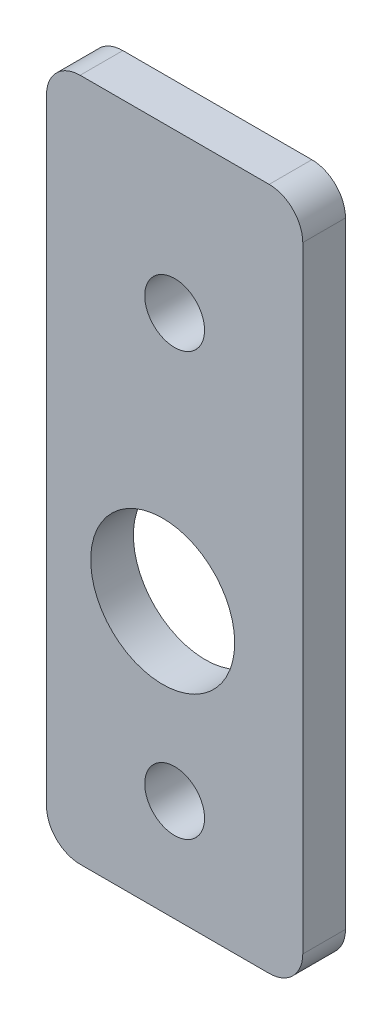
from build123d import *

# Parameters (mm, degrees)
SKETCH1_W           = 38.1
SKETCH1_H           = 101.6
SKETCH1_R           = 10.7061
BOSS_EXTRUDE1_DEPTH = 6.35
CUT_EXTRUDE1_REACH  = 110.694
SKETCH2_R           = 4.445
FILLET1_R           = 5


with BuildPart() as part:
    # Sketch1 → Boss-Extrude1 (new body)
    with BuildSketch(Plane.XY):
        with Locations((19.05, -50.8)):
            Rectangle(SKETCH1_W, SKETCH1_H)
        with Locations((17.272, -61.6)):
            Circle(SKETCH1_R, mode=Mode.SUBTRACT)
    extrude(amount=BOSS_EXTRUDE1_DEPTH)

    # Sketch2 → Cut-Extrude1 (cut, up to next)
    with BuildSketch(Plane.XY.offset(6.35), mode=Mode.PRIVATE) as cut_extrude1_sk1:
        with Locations((19.05, -23.588381621)):
            Circle(SKETCH2_R)
    cut_extrude1_tool1 = extrude(cut_extrude1_sk1.sketch, amount=-CUT_EXTRUDE1_REACH, mode=Mode.PRIVATE) & part.part
    # Sketch2 → Cut-Extrude1 (cut, up to next)
    with BuildSketch(Plane.XY.offset(6.35), mode=Mode.PRIVATE) as cut_extrude1_sk2:
        with Locations((19.05, -86.425541616)):
            Circle(SKETCH2_R)
    cut_extrude1_tool2 = extrude(cut_extrude1_sk2.sketch, amount=-CUT_EXTRUDE1_REACH, mode=Mode.PRIVATE) & part.part
    add(cut_extrude1_tool1.solids().sort_by_distance((19.05, -23.588382, 6.35))[0], mode=Mode.SUBTRACT)
    add(cut_extrude1_tool2.solids().sort_by_distance((19.05, -86.425542, 6.35))[0], mode=Mode.SUBTRACT)

    # Fillet1
    fillet1_edges = [part.edges().sort_by_distance(p)[0] for p in [
        (0, 0, 3.175),
        (38.1, 0, 3.175),
        (38.1, -101.6, 3.175),
        (0, -101.6, 3.175),
    ]]
    fillet(fillet1_edges, radius=FILLET1_R)


solid = part.part
